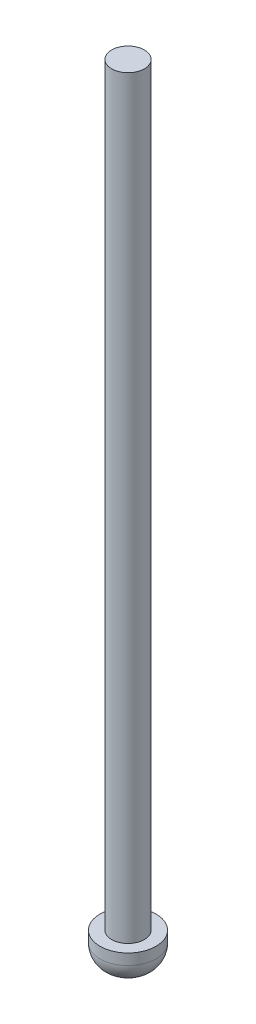
from build123d import *

# Parameters (mm, degrees)
CROQUIS2_R              = 17.25
SALIENTE_EXTRUIR1_DEPTH = 794.82
CROQUIS4_R              = 29.5
SALIENTE_EXTRUIR2_DEPTH = 33.5
REDONDEO2_R             = 22


with BuildPart() as part:
    # Croquis2 → Saliente-Extruir1 (new body)
    with BuildSketch(Plane(origin=(0, 0, 0), x_dir=(1, 0, 0), z_dir=(0, 1, 0))):
        with Locations(Location((0, 0, 0), (0, 0, 270))):
            Circle(CROQUIS2_R)
    extrude(amount=SALIENTE_EXTRUIR1_DEPTH)

    # Croquis4 → Saliente-Extruir2 (add)
    with BuildSketch(Plane.XZ):
        with Locations(Location((0, 0, 0), (0, 0, 270))):
            Circle(CROQUIS4_R)
    extrude(amount=SALIENTE_EXTRUIR2_DEPTH)

    # Redondeo2
    redondeo2_edges = [part.edges().sort_by_distance(p)[0] for p in [
        (0, -33.5, 29.5),
    ]]
    fillet(redondeo2_edges, radius=REDONDEO2_R)


solid = part.part
